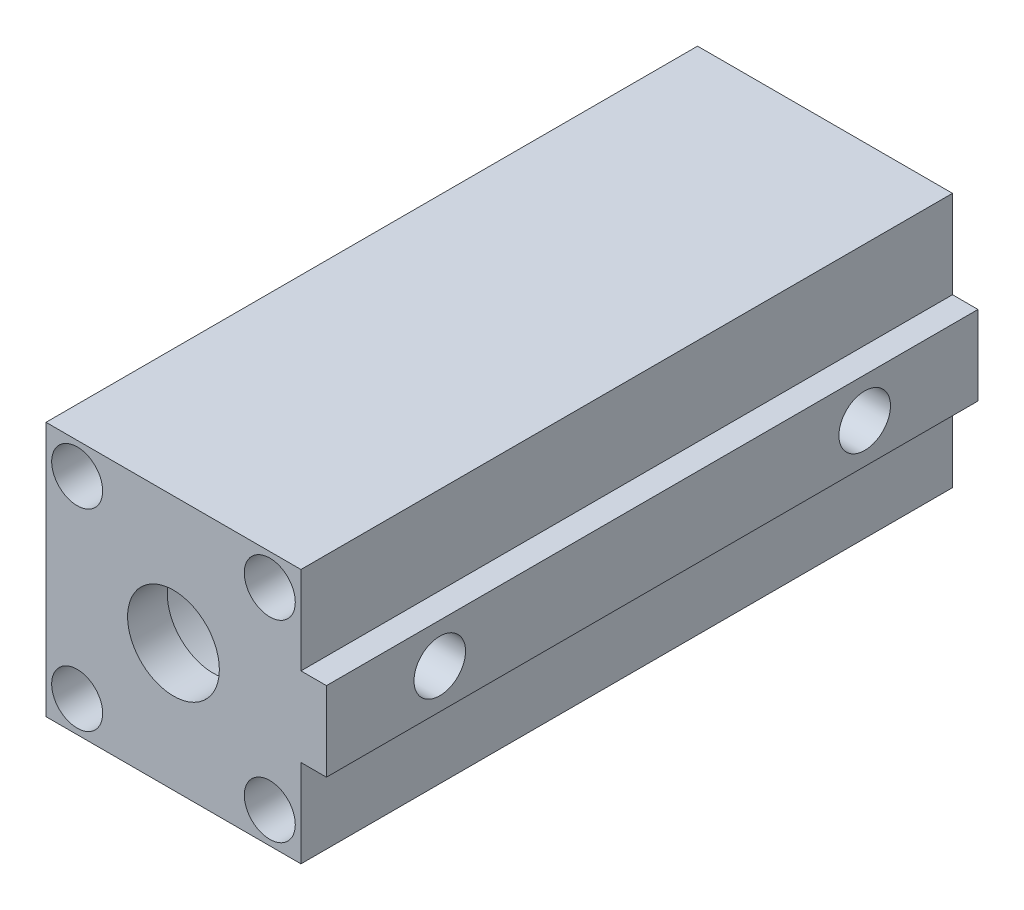
from build123d import *

# Parameters (mm, degrees)
SKETCH1_W                                      = 45
SKETCH1_H                                      = 45
SKETCH1_R                                      = 2.75
SKETCH1_R_2                                    = 16
SMC_45_MM_SQUARE_BODY_AND_FOUR_5_5_MM_TH_DEPTH = 115
SKETCH2_R                                      = 16
HEAD_END_CLEARANCE_ENVELOPE_DEPTH              = 7
ROD_START                                      = 108
SKETCH3_R                                      = 16
SKETCH3_R_2                                    = 8.1
ROD_COVER_AND_16_MM_ROD_CLEARANCE_DEPTH        = 7
SKETCH4_R                                      = 4.5
REAR_BOLT_HEAD_COUNTERBORES_DEPTH              = 7
FRONT_START                                    = 108
SKETCH5_R                                      = 4.5
FRONT_MOUNTING_COUNTERBORES_DEPTH              = 7
CATALOG_START                                  = 22.4
SKETCH6_W                                      = 115
SKETCH6_H                                      = 14
CATALOG_14_MM_WIDE_PORT_BOSS_PROJECTION_DEPTH  = 4.6
TOP_START                                      = 27
SKETCH7_R                                      = 4.55
TOP_RC_1_8_PORTS_20_MM_FROM_EACH_END_DEPTH     = 7


with BuildPart() as part:
    # Sketch1 → SMC 45 mm square body and four 5.5 mm through holes (new body)
    with BuildSketch(Plane.XY):
        Rectangle(SKETCH1_W, SKETCH1_H)
        with Locations((-17, -17)):
            Circle(SKETCH1_R, mode=Mode.SUBTRACT)
        with Locations((-17, 17)):
            Circle(SKETCH1_R, mode=Mode.SUBTRACT)
        with Locations((17, -17)):
            Circle(SKETCH1_R, mode=Mode.SUBTRACT)
        with Locations((17, 17)):
            Circle(SKETCH1_R, mode=Mode.SUBTRACT)
        Circle(SKETCH1_R_2, mode=Mode.SUBTRACT)
    extrude(amount=SMC_45_MM_SQUARE_BODY_AND_FOUR_5_5_MM_TH_DEPTH)

    # Sketch2 → Head end clearance envelope (add)
    with BuildSketch(Plane.XY):
        Circle(SKETCH2_R)
    extrude(amount=HEAD_END_CLEARANCE_ENVELOPE_DEPTH)

    # Sketch3 → Rod cover and 16 mm rod clearance (add)
    with BuildSketch(Plane.XY.offset(ROD_START)):
        Circle(SKETCH3_R)
        Circle(SKETCH3_R_2, mode=Mode.SUBTRACT)
    extrude(amount=ROD_COVER_AND_16_MM_ROD_CLEARANCE_DEPTH)

    # Sketch4 → Rear bolt head counterbores (cut)
    with BuildSketch(Plane.XY):
        with Locations((-17, -17)):
            Circle(SKETCH4_R)
        with Locations((-17, 17)):
            Circle(SKETCH4_R)
        with Locations((17, -17)):
            Circle(SKETCH4_R)
        with Locations((17, 17)):
            Circle(SKETCH4_R)
    extrude(amount=REAR_BOLT_HEAD_COUNTERBORES_DEPTH, mode=Mode.SUBTRACT)

    # Sketch5 → Front mounting counterbores (cut)
    with BuildSketch(Plane.XY.offset(FRONT_START)):
        with Locations((-17, -17)):
            Circle(SKETCH5_R)
        with Locations((-17, 17)):
            Circle(SKETCH5_R)
        with Locations((17, -17)):
            Circle(SKETCH5_R)
        with Locations((17, 17)):
            Circle(SKETCH5_R)
    extrude(amount=FRONT_MOUNTING_COUNTERBORES_DEPTH, mode=Mode.SUBTRACT)

    # Sketch6 → Catalog 14 mm wide port boss projection (add)
    with BuildSketch(Plane(origin=(0, 0, 0), x_dir=(0, 0, -1), z_dir=(1, 0, 0)).offset(CATALOG_START)):
        with Locations((-57.5, 0)):
            Rectangle(SKETCH6_W, SKETCH6_H)
    extrude(amount=CATALOG_14_MM_WIDE_PORT_BOSS_PROJECTION_DEPTH)

    # Sketch7 → Top Rc 1/8 ports, 20 mm from each end (cut)
    with BuildSketch(Plane(origin=(0, 0, 0), x_dir=(0, 0, -1), z_dir=(1, 0, 0)).offset(TOP_START)):
        with Locations((-20, 0)):
            Circle(SKETCH7_R)
        with Locations((-95, 0)):
            Circle(SKETCH7_R)
    extrude(amount=-TOP_RC_1_8_PORTS_20_MM_FROM_EACH_END_DEPTH, mode=Mode.SUBTRACT)


solid = part.part
